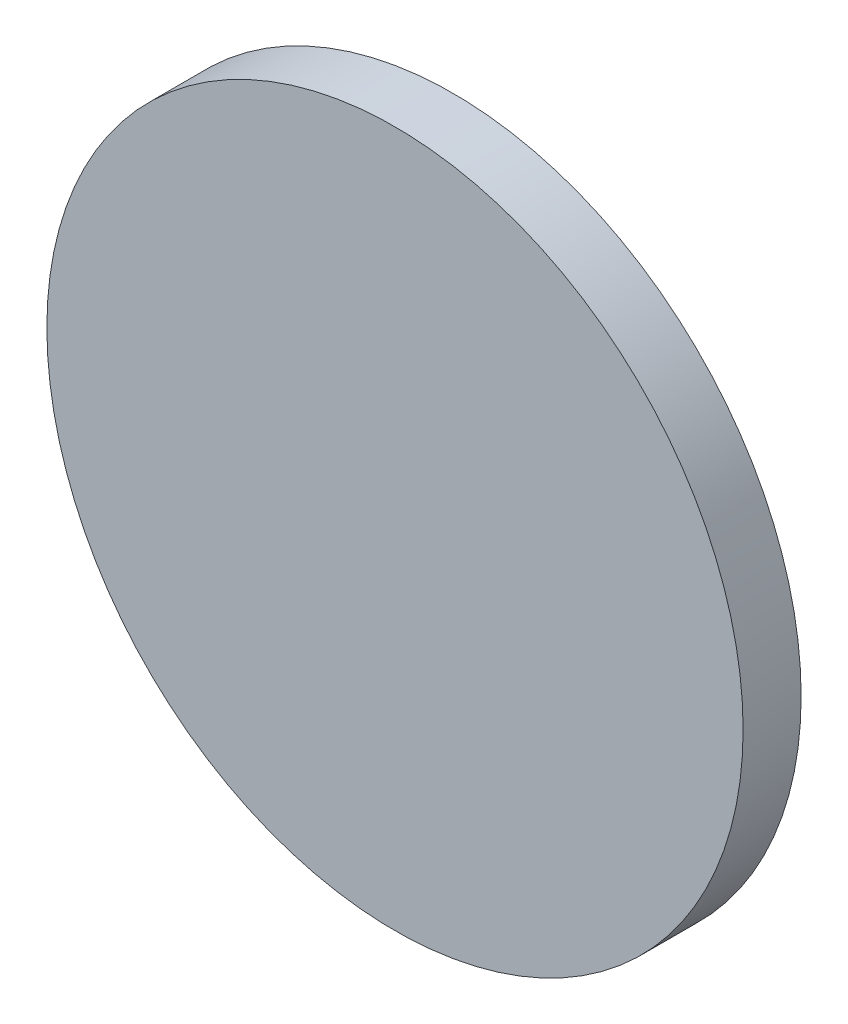
from build123d import *

# Parameters (mm, degrees)
SKETCH1_R           = 76.2
BOSS_EXTRUDE1_DEPTH = 12.7


with BuildPart() as part:
    # Sketch1 → Boss-Extrude1 (new body)
    with BuildSketch(Plane.XY):
        Circle(SKETCH1_R)
    extrude(amount=BOSS_EXTRUDE1_DEPTH)


solid = part.part
